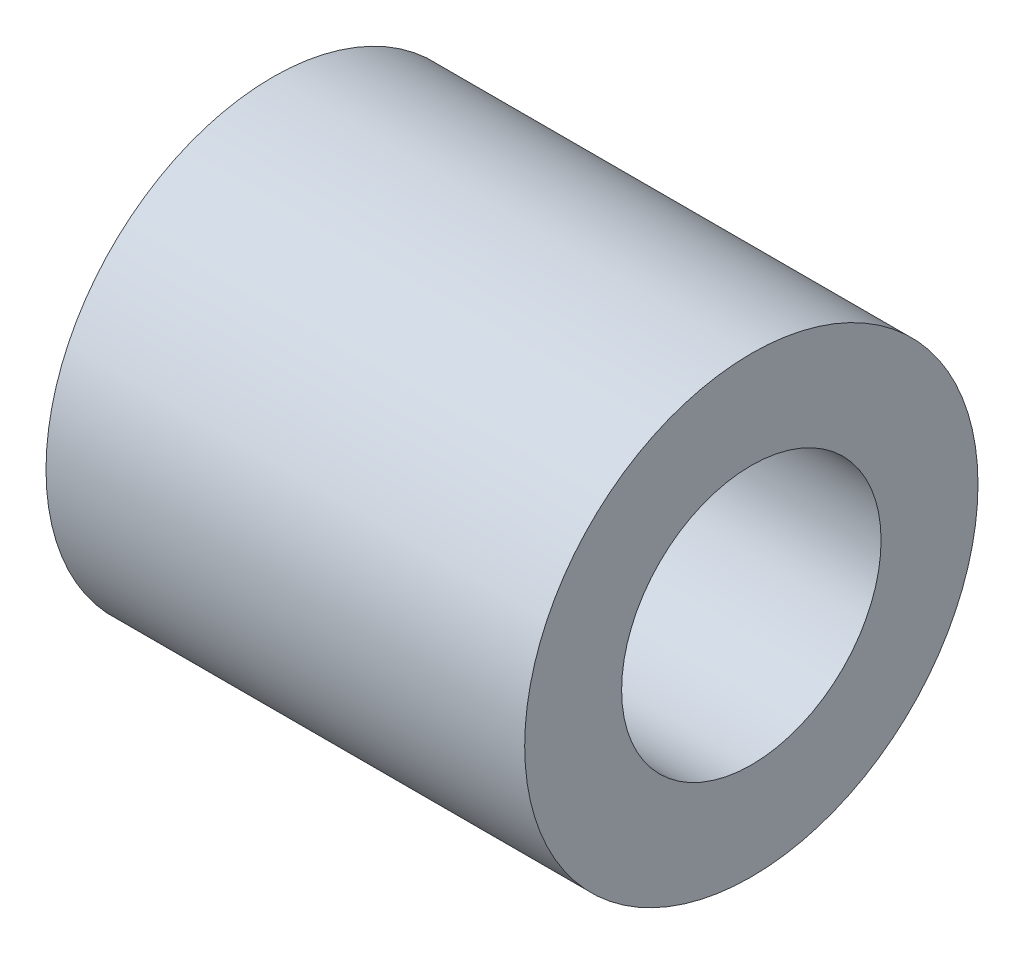
from build123d import *

# Parameters (mm, degrees)
SKETCH1_R           = 47.35
SKETCH1_R_2         = 27.1
BOSS_EXTRUDE1_DEPTH = 100


with BuildPart() as part:
    # Sketch1 → Boss-Extrude1 (new body)
    with BuildSketch(Plane(origin=(0, 0, 0), x_dir=(0, 0, -1), z_dir=(1, 0, 0))):
        Circle(SKETCH1_R)
        Circle(SKETCH1_R_2, mode=Mode.SUBTRACT)
    extrude(amount=BOSS_EXTRUDE1_DEPTH)


solid = part.part
